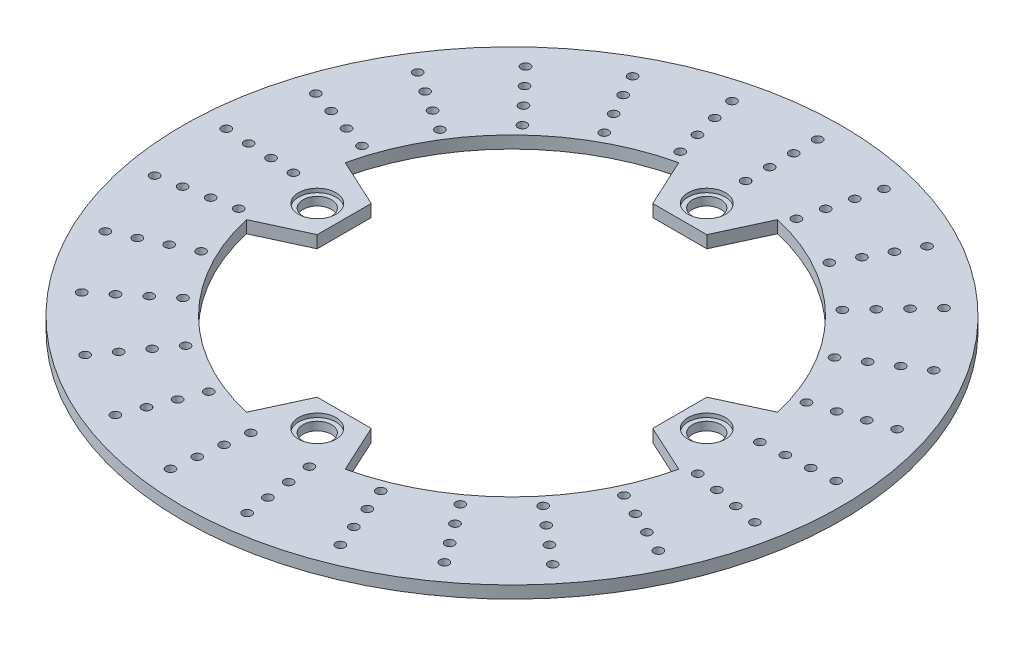
from build123d import *

# Parameters (mm, degrees)
SKETCH1_R           = 110
SKETCH1_R_2         = 4.75
BOSS_EXTRUDE1_DEPTH = 4.1
SKETCH3_R           = 1.5
CUT_EXTRUDE1_DEPTH  = 4.5
CIRPATTERN1_COUNT   = 25
SKETCH4_OUTSIDE_W   = 284.23
SKETCH4_OUTSIDE_H   = 284.23
SKETCH4_OUTSIDE_R   = 110
SKETCH4_OUTSIDE_R_2 = 6.25
CUT_EXTRUDE2_DEPTH  = 1.3
CIRPATTERN2_COUNT   = 4


with BuildPart() as part:
    # Sketch1 → Boss-Extrude1 (new body)
    with BuildSketch(Plane(origin=(0, 0, 0), x_dir=(1, 0, 0), z_dir=(0, 1, 0))):
        with Locations(Location((0, 0, 0), (0, 0, 270))):
            Circle(SKETCH1_R)
        with Locations(Location((0, 65, 0), (0, 0, 270))):
            Circle(SKETCH1_R_2, mode=Mode.SUBTRACT)
        with Locations(Location((65, 0, 0), (0, 0, 270))):
            Circle(SKETCH1_R_2, mode=Mode.SUBTRACT)
        with Locations(Location((0, -65, 0), (0, 0, 270))):
            Circle(SKETCH1_R_2, mode=Mode.SUBTRACT)
        with Locations(Location((-65, 0, 0), (0, 0, 270))):
            Circle(SKETCH1_R_2, mode=Mode.SUBTRACT)
        with BuildLine():
            Line((-9.02, 56), (9.02, 56))
            Line((9.02, 56), (16.470147493, 72.1438441))
            ThreePointArc((16.470147493, 72.1438441), (52.325901808, 52.325901808), (72.1438441, 16.470147493))
            Line((72.1438441, 16.470147493), (56, 9.02))
            Line((56, 9.02), (56, -9.02))
            Line((56, -9.02), (72.1438441, -16.470147493))
            ThreePointArc((72.1438441, -16.470147493), (52.325901808, -52.325901808), (16.470147493, -72.1438441))
            Line((16.470147493, -72.1438441), (9.02, -56))
            Line((9.02, -56), (-9.02, -56))
            Line((-9.02, -56), (-16.470147493, -72.1438441))
            ThreePointArc((-16.470147493, -72.1438441), (-52.325901808, -52.325901808), (-72.1438441, -16.470147493))
            Line((-72.1438441, -16.470147493), (-56, -9.02))
            Line((-56, -9.02), (-56, 9.02))
            Line((-56, 9.02), (-72.1438441, 16.470147493))
            ThreePointArc((-72.1438441, 16.470147493), (-52.325901808, 52.325901808), (-16.470147493, 72.1438441))
            Line((-16.470147493, 72.1438441), (-9.02, 56))
        make_face(mode=Mode.SUBTRACT)
    extrude(amount=BOSS_EXTRUDE1_DEPTH)

    # Sketch3 → Cut-Extrude1 (cut)
    with BuildSketch(Plane(origin=(0, 0, 0), x_dir=(1, 0, 0), z_dir=(0, 1, 0))):
        with Locations(Location((0, 102, 0), (0, 0, 270))):
            Circle(SKETCH3_R)
        with Locations(Location((0, 94, 0), (0, 0, 270))):
            Circle(SKETCH3_R)
        with Locations(Location((0, 86, 0), (0, 0, 270))):
            Circle(SKETCH3_R)
        with Locations(Location((0, 78, 0), (0, 0, 270))):
            Circle(SKETCH3_R)
    cut_extrude1 = extrude(amount=CUT_EXTRUDE1_DEPTH, mode=Mode.SUBTRACT)

    # CirPattern1: Cut-Extrude1 ×25 about axis
    cirpattern1_axis = Axis((0, 0, 0), (0, 1, 0))
    for i in range(1, CIRPATTERN1_COUNT):
        add(cut_extrude1.rotate(cirpattern1_axis, i * 360 / CIRPATTERN1_COUNT), mode=Mode.SUBTRACT)

    # Sketch4 outside → Cut-Extrude2 (cut)
    # profile 1 of 2: a face of its own
    with BuildSketch(Plane(origin=(0, 4.1, 0), x_dir=(1, 0, 0), z_dir=(0, 1, 0))):
        Rectangle(SKETCH4_OUTSIDE_W, SKETCH4_OUTSIDE_H)
        with Locations(Location((0, 0, 0), (0, 0, 270))):
            Circle(SKETCH4_OUTSIDE_R, mode=Mode.SUBTRACT)
    # profile 2 of 2: a face of its own
    with BuildSketch(Plane(origin=(0, 4.1, 0), x_dir=(1, 0, 0), z_dir=(0, 1, 0))):
        with Locations(Location((0, 65, 0), (0, 0, 270))):
            Circle(SKETCH4_OUTSIDE_R_2)
    cut_extrude2 = extrude(amount=-CUT_EXTRUDE2_DEPTH, mode=Mode.SUBTRACT)

    # CirPattern2: Cut-Extrude2 ×4 about axis
    cirpattern2_axis = Axis((0, 0, 0), (0, 1, 0))
    for i in range(1, CIRPATTERN2_COUNT):
        add(cut_extrude2.rotate(cirpattern2_axis, i * 360 / CIRPATTERN2_COUNT), mode=Mode.SUBTRACT)


solid = part.part
